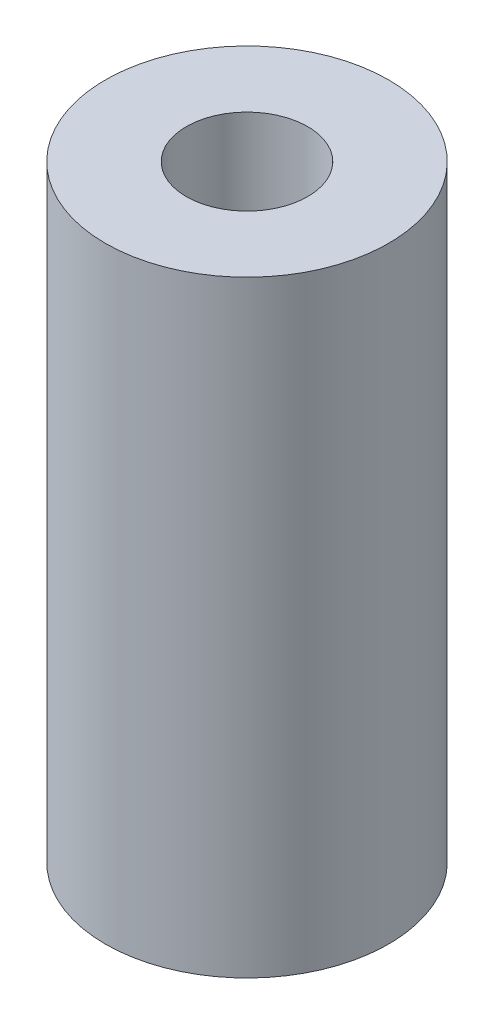
from build123d import *

# Parameters (mm, degrees)
SKETCH_1_R      = 3.5
SKETCH_1_R_2    = 1.5
EXTRUDE_1_DEPTH = 15


with BuildPart() as part:
    # 草图1 → 凸台-拉伸1 (new body)
    with BuildSketch(Plane(origin=(0, 0, 0), x_dir=(1, 0, 0), z_dir=(0, 1, 0))):
        with Locations(Location((0, 0, 0), (0, 0, 270))):
            Circle(SKETCH_1_R)
        with Locations(Location((0, 0, 0), (0, 0, 270))):
            Circle(SKETCH_1_R_2, mode=Mode.SUBTRACT)
    extrude(amount=EXTRUDE_1_DEPTH)


solid = part.part
